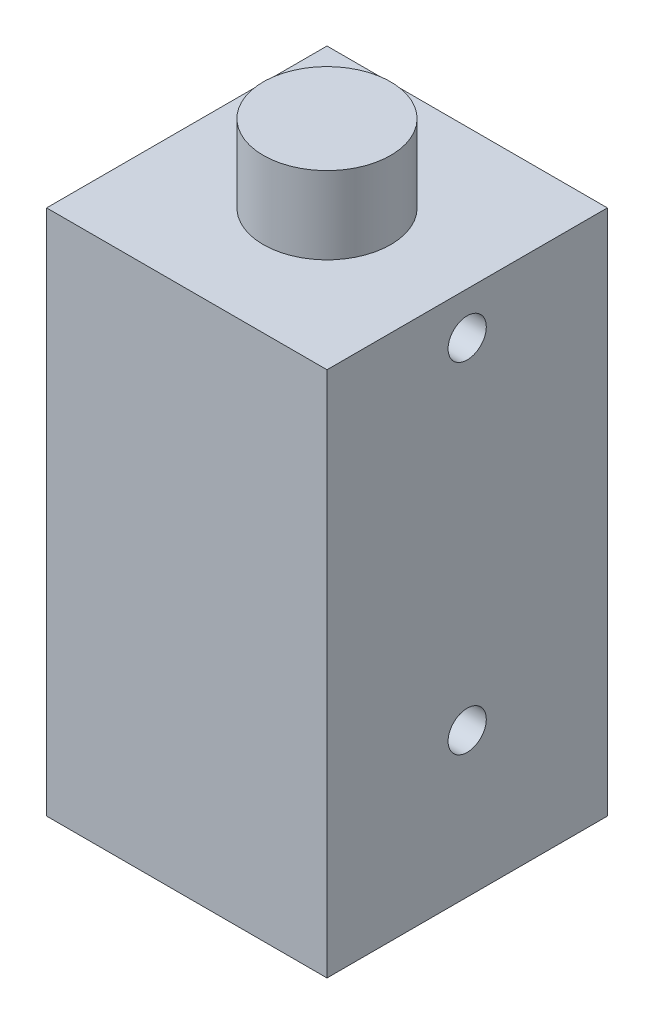
from build123d import *

# Parameters (mm, degrees)
SKETCH1_W           = 33
SKETCH1_H           = 33
BOSS_EXTRUDE1_DEPTH = 62
SKETCH2_R           = 7.5
BOSS_EXTRUDE2_DEPTH = 9.1
SKETCH3_R           = 2.25
CUT_EXTRUDE1_DEPTH  = 9.1


with BuildPart() as part:
    # Sketch1 → Boss-Extrude1 (new body)
    with BuildSketch(Plane(origin=(0, 0, 0), x_dir=(1, 0, 0), z_dir=(0, 1, 0))):
        Rectangle(SKETCH1_W, SKETCH1_H)
    extrude(amount=BOSS_EXTRUDE1_DEPTH)

    # Sketch2 → Boss-Extrude2 (add)
    with BuildSketch(Plane(origin=(0, 62, 0), x_dir=(1, 0, 0), z_dir=(0, 1, 0))):
        with Locations(Location((0, 0, 0), (0, 0, 270))):
            Circle(SKETCH2_R)
    extrude(amount=BOSS_EXTRUDE2_DEPTH)

    # Sketch3 → Cut-Extrude1 (cut)
    with BuildSketch(Plane(origin=(16.5, 0, 0), x_dir=(0, 0, -1), z_dir=(1, 0, 0))):
        with Locations((0, 57)):
            Circle(SKETCH3_R)
        with Locations((0, 17)):
            Circle(SKETCH3_R)
    extrude(amount=-CUT_EXTRUDE1_DEPTH, mode=Mode.SUBTRACT)


solid = part.part
